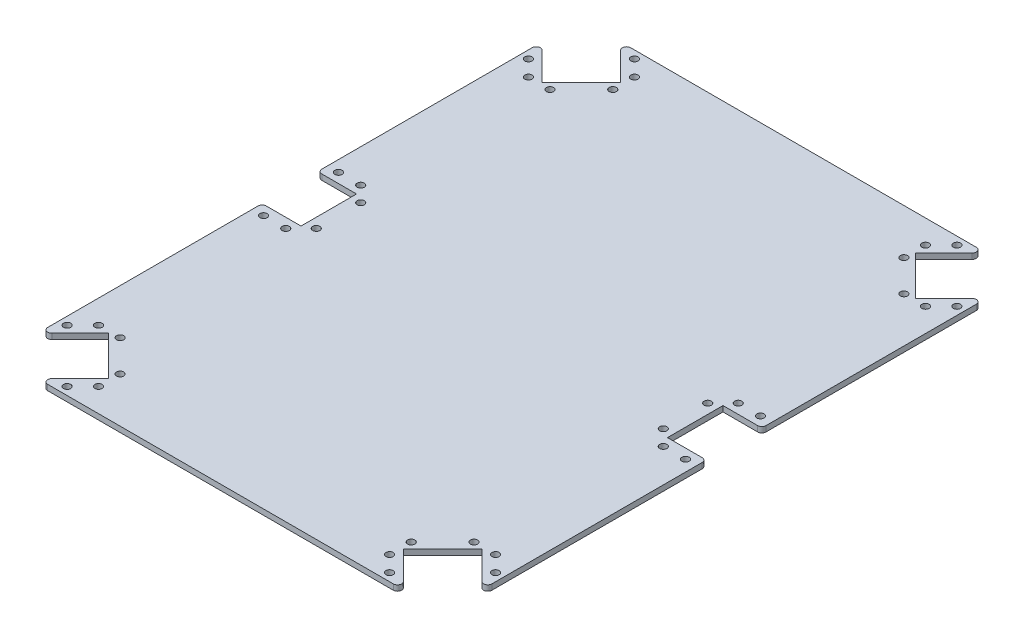
from build123d import *

# Parameters (mm, degrees)
SKETCH2_W           = 160
SKETCH2_H           = 210
SKETCH2_R           = 1.3
BOSS_EXTRUDE1_DEPTH = 2
SKETCH3_W           = 14
SKETCH3_H           = 20
CUT_EXTRUDE1_DEPTH  = 2
FILLET1_R           = 1.5


with BuildPart() as part:
    # Sketch2 → Boss-Extrude1 (new body)
    with BuildSketch(Plane(origin=(0, 0, 0), x_dir=(1, 0, 0), z_dir=(0, 1, 0))):
        Rectangle(SKETCH2_W, SKETCH2_H)
        with Locations(Location((52.422835534, 88.736544033, 0), (0, 0, 270))):
            Circle(SKETCH2_R, mode=Mode.SUBTRACT)
        with Locations(Location((52.422835534, 96.514718626, 0), (0, 0, 270))):
            Circle(SKETCH2_R, mode=Mode.SUBTRACT)
        with Locations(Location((58.079689783, 102.171572875, 0), (0, 0, 270))):
            Circle(SKETCH2_R, mode=Mode.SUBTRACT)
        with Locations(Location((76, 13.5, 0), (0, 0, 270))):
            Circle(SKETCH2_R, mode=Mode.SUBTRACT)
        with Locations(Location((68, 13.5, 0), (0, 0, 270))):
            Circle(SKETCH2_R, mode=Mode.SUBTRACT)
        with Locations(Location((62.5, 8, 0), (0, 0, 270))):
            Circle(SKETCH2_R, mode=Mode.SUBTRACT)
        with Locations(Location((62.5, -8, 0), (0, 0, 90))):
            Circle(SKETCH2_R, mode=Mode.SUBTRACT)
        with Locations(Location((68, -13.5, 0), (0, 0, 90))):
            Circle(SKETCH2_R, mode=Mode.SUBTRACT)
        with Locations(Location((76, -13.5, 0), (0, 0, 90))):
            Circle(SKETCH2_R, mode=Mode.SUBTRACT)
        with Locations(Location((77.171572875, 83.079689783, 0), (0, 0, 90))):
            Circle(SKETCH2_R, mode=Mode.SUBTRACT)
        with Locations(Location((71.514718626, 77.422835534, 0), (0, 0, 90))):
            Circle(SKETCH2_R, mode=Mode.SUBTRACT)
        with Locations(Location((63.736544033, 77.422835534, 0), (0, 0, 90))):
            Circle(SKETCH2_R, mode=Mode.SUBTRACT)
        with Locations(Location((77.171572875, -83.079689783, 0), (0, 0, 270))):
            Circle(SKETCH2_R, mode=Mode.SUBTRACT)
        with Locations(Location((71.514718626, -77.422835534, 0), (0, 0, 270))):
            Circle(SKETCH2_R, mode=Mode.SUBTRACT)
        with Locations(Location((63.736544033, -77.422835534, 0), (0, 0, 270))):
            Circle(SKETCH2_R, mode=Mode.SUBTRACT)
        with Locations(Location((58.079689783, -102.171572875, 0), (0, 0, 90))):
            Circle(SKETCH2_R, mode=Mode.SUBTRACT)
        with Locations(Location((52.422835534, -96.514718626, 0), (0, 0, 90))):
            Circle(SKETCH2_R, mode=Mode.SUBTRACT)
        with Locations(Location((52.422835534, -88.736544033, 0), (0, 0, 90))):
            Circle(SKETCH2_R, mode=Mode.SUBTRACT)
        with Locations(Location((-58.079689783, 102.171572875, 0), (0, 0, 90))):
            Circle(SKETCH2_R, mode=Mode.SUBTRACT)
        with Locations(Location((-52.422835534, 96.514718626, 0), (0, 0, 90))):
            Circle(SKETCH2_R, mode=Mode.SUBTRACT)
        with Locations(Location((-52.422835534, 88.736544033, 0), (0, 0, 90))):
            Circle(SKETCH2_R, mode=Mode.SUBTRACT)
        with Locations(Location((-77.171572875, 83.079689783, 0), (0, 0, 270))):
            Circle(SKETCH2_R, mode=Mode.SUBTRACT)
        with Locations(Location((-71.514718626, 77.422835534, 0), (0, 0, 270))):
            Circle(SKETCH2_R, mode=Mode.SUBTRACT)
        with Locations(Location((-63.736544033, 77.422835534, 0), (0, 0, 270))):
            Circle(SKETCH2_R, mode=Mode.SUBTRACT)
        with Locations(Location((-77.171572875, -83.079689783, 0), (0, 0, 90))):
            Circle(SKETCH2_R, mode=Mode.SUBTRACT)
        with Locations(Location((-71.514718626, -77.422835534, 0), (0, 0, 90))):
            Circle(SKETCH2_R, mode=Mode.SUBTRACT)
        with Locations(Location((-63.736544033, -77.422835534, 0), (0, 0, 90))):
            Circle(SKETCH2_R, mode=Mode.SUBTRACT)
        with Locations(Location((-52.422835534, -88.736544033, 0), (0, 0, 270))):
            Circle(SKETCH2_R, mode=Mode.SUBTRACT)
        with Locations(Location((-52.422835534, -96.514718626, 0), (0, 0, 270))):
            Circle(SKETCH2_R, mode=Mode.SUBTRACT)
        with Locations(Location((-58.079689783, -102.171572875, 0), (0, 0, 270))):
            Circle(SKETCH2_R, mode=Mode.SUBTRACT)
        with Locations(Location((-62.5, -8, 0), (0, 0, 270))):
            Circle(SKETCH2_R, mode=Mode.SUBTRACT)
        with Locations(Location((-68, -13.5, 0), (0, 0, 270))):
            Circle(SKETCH2_R, mode=Mode.SUBTRACT)
        with Locations(Location((-76, -13.5, 0), (0, 0, 270))):
            Circle(SKETCH2_R, mode=Mode.SUBTRACT)
        with Locations(Location((-76, 13.5, 0), (0, 0, 90))):
            Circle(SKETCH2_R, mode=Mode.SUBTRACT)
        with Locations(Location((-68, 13.5, 0), (0, 0, 90))):
            Circle(SKETCH2_R, mode=Mode.SUBTRACT)
        with Locations(Location((-62.5, 8, 0), (0, 0, 90))):
            Circle(SKETCH2_R, mode=Mode.SUBTRACT)
    extrude(amount=BOSS_EXTRUDE1_DEPTH)

    # Sketch3 → Cut-Extrude1 (cut)
    with BuildSketch(Plane(origin=(0, 2, 0), x_dir=(1, 0, 0), z_dir=(0, 1, 0))):
        with Locations((73, 0)):
            Rectangle(SKETCH3_W, SKETCH3_H)
        Polygon((65.857864376, 105), (53.129942315, 92.272077939), (67.272077939, 78.129942315), (80, 90.857864376), (80, 105), align=None)
        Polygon((80, -90.857864376), (80, -105), (65.857864376, -105), (53.129942315, -92.272077939), (67.272077939, -78.129942315), align=None)
        Polygon((-80, 90.857864376), (-80, 105), (-65.857864376, 105), (-53.129942315, 92.272077939), (-67.272077939, 78.129942315), align=None)
        with Locations((-73, 0)):
            Rectangle(SKETCH3_W, SKETCH3_H)
        Polygon((-67.272077939, -78.129942315), (-80, -90.857864376), (-80, -105), (-65.857864376, -105), (-53.129942315, -92.272077939), align=None)
    extrude(amount=-CUT_EXTRUDE1_DEPTH, mode=Mode.SUBTRACT)

    # Fillet1
    fillet1_edges = [part.edges().sort_by_distance(p)[0] for p in [
        (65.857864376, 1, -105),
        (80, 1, -90.857864376),
        (80, 1, 90.857864376),
        (65.857864376, 1, 105),
        (-80, 1, -90.857864376),
        (-65.857864376, 1, -105),
        (-80, 1, 10),
        (-80, 1, -10),
        (-65.857864376, 1, 105),
        (-80, 1, 90.857864376),
        (80, 1, -10),
        (80, 1, 10),
    ]]
    fillet(fillet1_edges, radius=FILLET1_R)


solid = part.part
